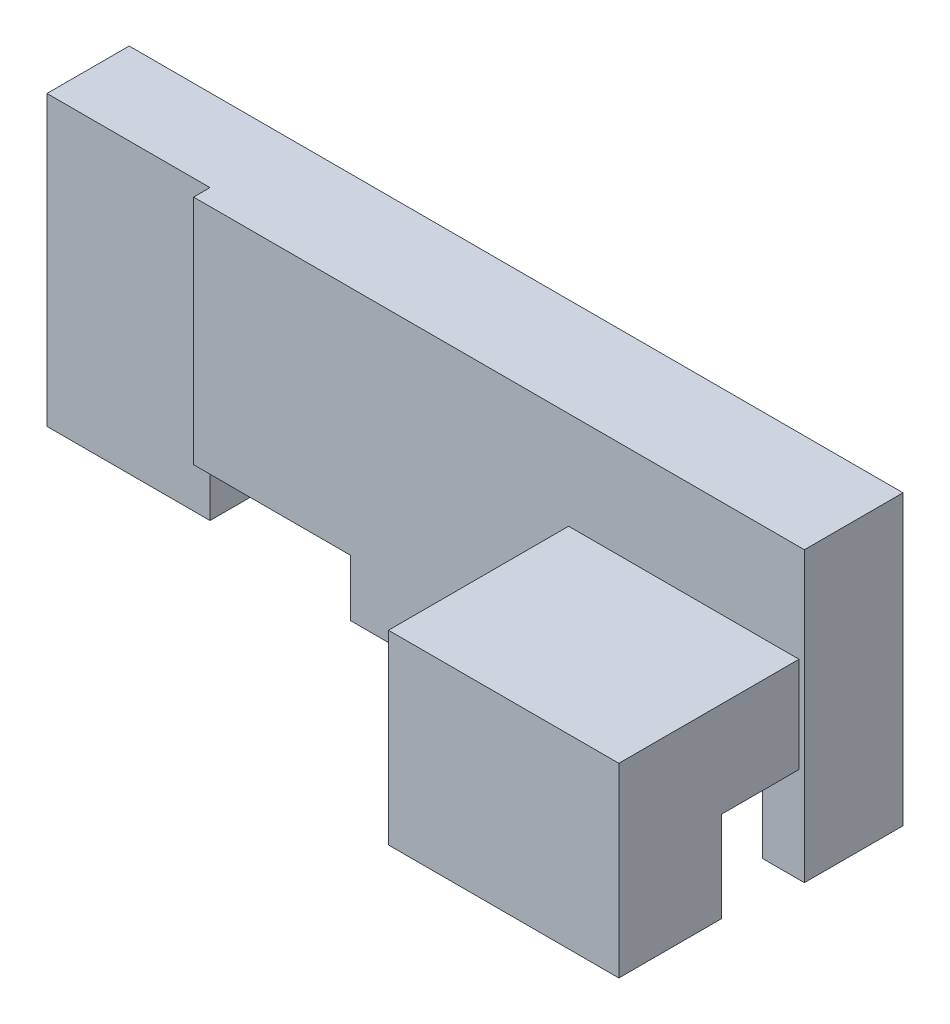
from build123d import *

# Parameters (mm, degrees)
DODANIE_WYCI_GNI_CIE9_DEPTH       = 210
DODANIE_WYCI_GNI_CIE9_2_DEPTH     = 210
DODANIE_WYCI_GNI_CIE9_3_DEPTH     = 210
DODANIE_WYCI_GNI_CIE10_DEPTH      = 860
DODANIE_WYCI_GNI_CIE11_DEPTH      = 490
DODANIE_WYCI_GNI_CIE11_DEPTH_BACK = 200
SZKIC7_W                          = 855
SZKIC7_H                          = 380
SZKIC8_W                          = 581.5
SZKIC8_H                          = 22.7
WYTNIJ_WYCI_GNI_CIE1_DEPTH        = 470
SZKIC9_W                          = 85
SZKIC9_H                          = 510
WYTNIJ_WYCI_GNI_CIE2_DEPTH        = 690
SZKIC11_W                         = 855
SZKIC11_H                         = 354.231627321
DODANIE_WYCI_GNI_CIE12_DEPTH      = 290


with BuildPart() as part:
    # Szkic4 → Dodanie-wyciągnięcie9 (new body)
    with BuildSketch(Plane(origin=(0, -690, 0), x_dir=(1, 0, 0), z_dir=(0, 1, 0))):
        Polygon((-290.75, -205.75), (-290.75, -35.542702064), (-895.75, -35.542702064), (-895.75, -340.542702064), (-290.75, -340.542702064), align=None)
    extrude(amount=DODANIE_WYCI_GNI_CIE9_DEPTH)



with BuildPart() as body_2:
    # Szkic4 → Dodanie-wyci_gni_cie9 2 (new body)
    with BuildSketch(Plane(origin=(0, -690, 0), x_dir=(1, 0, 0), z_dir=(0, 1, 0))):
        Polygon((290.75, -401.5), (1239.25, -401.5), (1239.25, -205.75), (1239.25, -35.542702064), (290.75, -35.542702064), (290.75, -205.75), align=None)
    extrude(amount=DODANIE_WYCI_GNI_CIE9_2_DEPTH)


with BuildPart() as body_3:
    # Szkic4 → Dodanie-wyci_gni_cie9 3 (new body)
    with BuildSketch(Plane(origin=(0, -690, 0), x_dir=(1, 0, 0), z_dir=(0, 1, 0))):
        Polygon((1820.75, -205.75), (1820.75, -35.542702064), (1975.75, -35.542702064), (1975.75, -401.5), (1820.75, -401.5), align=None)
    extrude(amount=DODANIE_WYCI_GNI_CIE9_3_DEPTH)


with BuildPart() as part_1:
    add(part.part)

    add(body_2.part)  # Dodanie-wyciągnięcie10 merges body 2

    add(body_3.part)  # Dodanie-wyciągnięcie10 merges body 3
    # Szkic6 → Dodanie-wyciągnięcie10 (add)
    with BuildSketch(Plane(origin=(0, -480, 0), x_dir=(1, 0, 0), z_dir=(0, 1, 0))):
        Polygon((1975.75, -35.542702064), (-895.75, -35.542702064), (-895.75, -340.542702064), (-290.75, -340.542702064), (-290.75, -401.5), (1975.75, -401.5), align=None)
    extrude(amount=DODANIE_WYCI_GNI_CIE10_DEPTH)

    # Szkic8 → Wytnij-wyciągnięcie1 (cut)
    with BuildSketch(Plane.XY.offset(401.5)):
        with Locations((1530, -468.65)):
            Rectangle(SZKIC8_W, SZKIC8_H)
    extrude(amount=-WYTNIJ_WYCI_GNI_CIE1_DEPTH, mode=Mode.SUBTRACT)

    # Szkic9 → Wytnij-wyciągnięcie2 (cut)
    with BuildSketch(Plane.ZY.offset(895.75)):
        with Locations((42.5, 0)):
            Rectangle(SZKIC9_W, SZKIC9_H)
    extrude(amount=-WYTNIJ_WYCI_GNI_CIE2_DEPTH, mode=Mode.SUBTRACT)


with BuildPart() as body_2_2:
    # Szkic7 → Dodanie-wyciągnięcie11 (new, two sides: drawn at the far end of the back side and taken through both)
    with BuildSketch(Plane(origin=(0, -452, 0), x_dir=(1, 0, 0), z_dir=(0, 1, 0)).offset(-DODANIE_WYCI_GNI_CIE11_DEPTH_BACK)):
        with Locations((1548.25, -900)):
            Rectangle(SZKIC7_W, SZKIC7_H)
    extrude(amount=DODANIE_WYCI_GNI_CIE11_DEPTH + DODANIE_WYCI_GNI_CIE11_DEPTH_BACK)

    # Szkic11 → Dodanie-wyciągnięcie12 (add)
    with BuildSketch(Plane.XY.offset(421.5)):
        with Locations((1548.25, -139.115813661)):
            Rectangle(SZKIC11_W, SZKIC11_H)
    extrude(amount=DODANIE_WYCI_GNI_CIE12_DEPTH)


solid = Compound([part_1.part, body_2_2.part])
